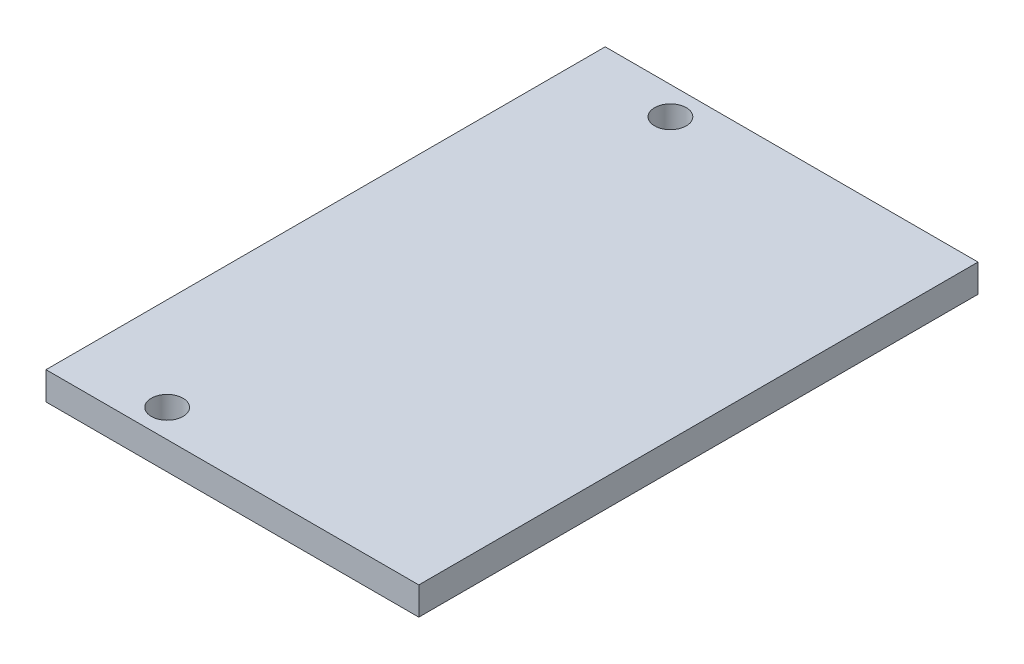
from build123d import *

# Parameters (mm, degrees)
SKETCH1_W           = 40
SKETCH1_H           = 60
SKETCH1_R           = 1.7
BOSS_EXTRUDE1_DEPTH = 3


with BuildPart() as part:
    # Sketch1 → Boss-Extrude1 (new body)
    with BuildSketch(Plane(origin=(0, 0, 0), x_dir=(1, 0, 0), z_dir=(0, 1, 0))):
        with Locations((10, 0)):
            Rectangle(SKETCH1_W, SKETCH1_H)
        with Locations(Location((0, 27, 0), (0, 0, 270))):
            Circle(SKETCH1_R, mode=Mode.SUBTRACT)
        with Locations(Location((0, -27, 0), (0, 0, 270))):
            Circle(SKETCH1_R, mode=Mode.SUBTRACT)
    extrude(amount=BOSS_EXTRUDE1_DEPTH)


solid = part.part
